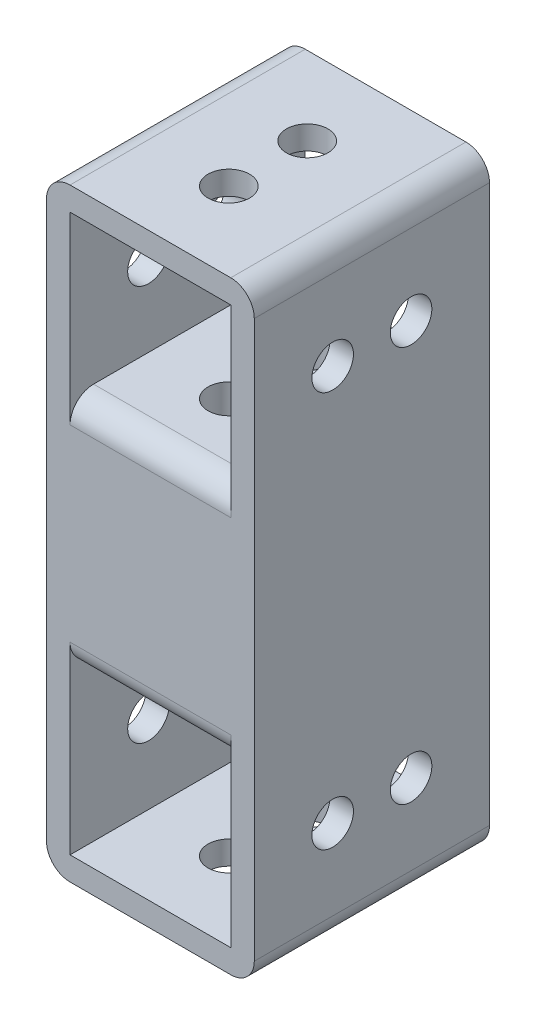
from build123d import *

# Parameters (mm, degrees)
SKETCH_1_W          = 20.5
SKETCH_1_H          = 30
EXTRUDE_1_DEPTH     = 30
FILLET_1_R          = 3
SKETCH_2_R          = 2.65
CUT_EXTRUDE_1_DEPTH = 84.693264365
SKETCH_3_R          = 2.65
CUT_EXTRUDE_2_DEPTH = 76.27491282
FILLET_2_R          = 3


with BuildPart() as part:
    # 草图1 → 凸台-拉伸1 (new body)
    # profile 1 of 2: a face of its own
    with BuildSketch(Plane.XY):
        Polygon((-13.25, -13.25), (-13.25, 10.25), (-13.25, 40.25), (-13.25, 63.75), (13.25, 63.75), (13.25, 40.25), (13.25, 10.25), (13.25, -13.25), align=None)
        Polygon((10.25, 40.25), (10.25, 60.75), (-10.25, 60.75), (-10.25, 40.25), (-10.25, 10.25), (-10.25, -10.25), (10.25, -10.25), (10.25, 10.25), align=None, mode=Mode.SUBTRACT)
    # profile 2 of 2: a face of its own
    with BuildSketch(Plane.XY):
        with Locations((0, 25.25)):
            Rectangle(SKETCH_1_W, SKETCH_1_H)
    extrude(amount=EXTRUDE_1_DEPTH)

    # 圆角1
    fillet_1_edges = [part.edges().sort_by_distance(p)[0] for p in [
        (-13.25, 63.75, 15),
        (13.25, 63.75, 15),
        (13.25, -13.25, 15),
        (-13.25, -13.25, 15),
    ]]
    fillet(fillet_1_edges, radius=FILLET_1_R)

    # 草图2 → 切除-拉伸1 (cut, through all)
    with BuildSketch(Plane(origin=(0, 63.75, 0), x_dir=(1, 0, 0), z_dir=(0, 1, 0))):
        with Locations(Location((0, -10, 0), (0, 0, 270))):
            Circle(SKETCH_2_R)
        with Locations(Location((0, -20, 0), (0, 0, 270))):
            Circle(SKETCH_2_R)
    extrude(amount=-CUT_EXTRUDE_1_DEPTH, mode=Mode.SUBTRACT)

    # 草图3 → 切除-拉伸2 (cut, through all)
    with BuildSketch(Plane(origin=(13.25, 0, 0), x_dir=(0, 0, -1), z_dir=(1, 0, 0))):
        with Locations((-10, 0)):
            Circle(SKETCH_3_R)
        with Locations((-20, 0)):
            Circle(SKETCH_3_R)
        with Locations(Location((-10, 50.5, 0), (0, 0, 180))):
            Circle(SKETCH_3_R)
        with Locations((-20, 50.5)):
            Circle(SKETCH_3_R)
    extrude(amount=-CUT_EXTRUDE_2_DEPTH, mode=Mode.SUBTRACT)

    # 圆角2
    fillet_2_edges = [part.edges().sort_by_distance(p)[0] for p in [
        (0, 40.25, 30),
        (0, 10.25, 0),
        (0, 40.25, 0),
        (0, 10.25, 30),
    ]]
    fillet(fillet_2_edges, radius=FILLET_2_R)


solid = part.part
